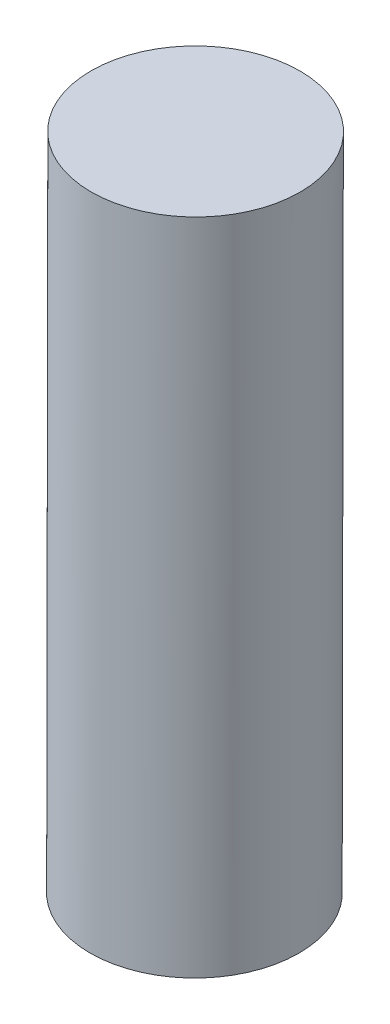
from build123d import *

# Parameters (mm, degrees)
SWEEP1_PROFILE_R = 4.699


with BuildPart() as part:
    # Sweep1: sweep along a curve in space
    with BuildLine() as sweep1_path:
        Line((-266.617064338, 133.219904817, 163.321796793), (-266.564789525, 162.850522994, 163.321796827))
    # Sweep1 profile (on start of the path) → Sweep1 (sweep)
    with BuildSketch(Plane(origin=(-266.617064338, 133.219904817, 163.321796793), x_dir=(0.999998443774466, -0.0017642133221912873, 0), z_dir=(0.0017642133221912873, 0.999998443774466, 1.1713654281314203e-09))):
        Circle(SWEEP1_PROFILE_R)
    sweep(path=sweep1_path.line)


solid = part.part
